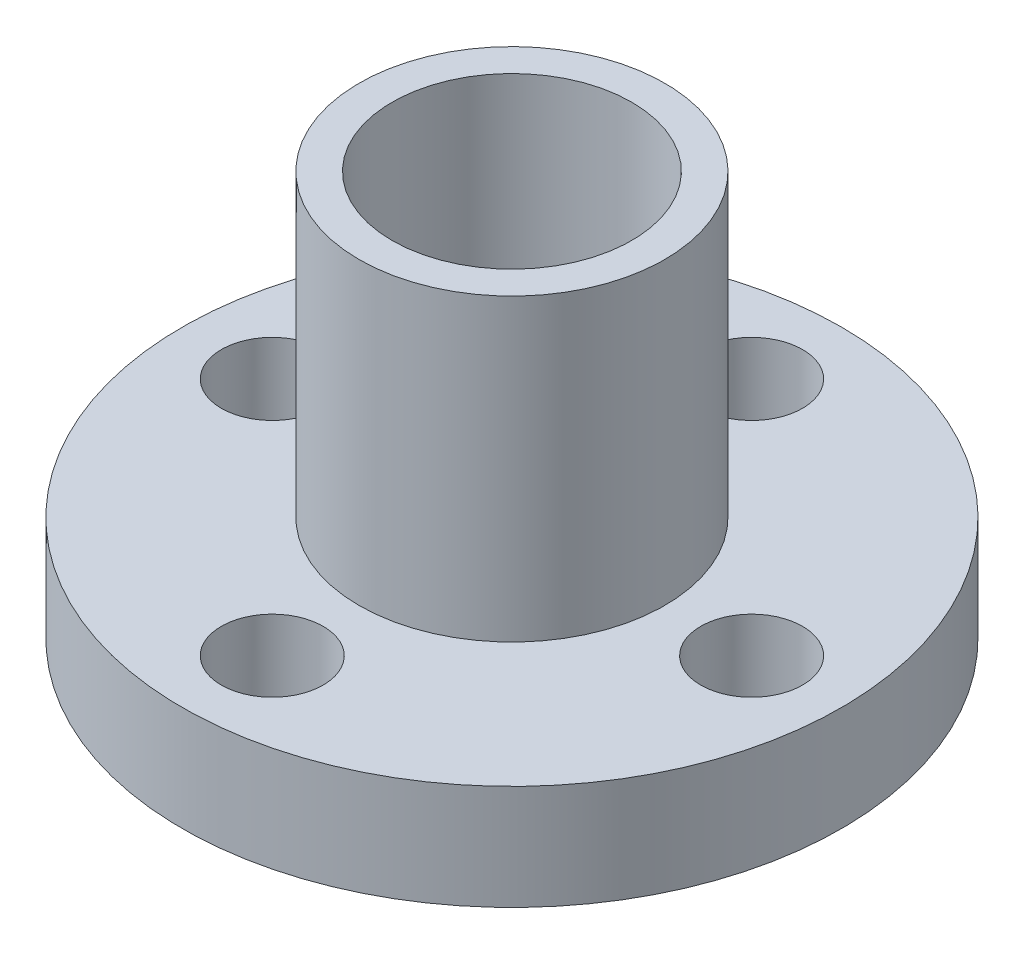
from build123d import *

# Parameters (mm, degrees)
SKETCH1_R            = 5.1
SKETCH1_R_2          = 4
BOSS_EXTRUDE1_DEPTH  = 10
SKETCH2_R            = 11
SKETCH2_R_2          = 4
BOSS_EXTRUDE2_DEPTH  = 3.5
SKETCH3_R            = 5.1
SKETCH3_R_2          = 4
BOSS_EXTRUDE3_DEPTH  = 1.5
M3_CLEARANCE_HOLE1_D = 3.4


with BuildPart() as part:
    # Sketch1 → Boss-Extrude1 (new body)
    with BuildSketch(Plane(origin=(0, 0, 0), x_dir=(1, 0, 0), z_dir=(0, 1, 0))):
        with Locations(Location((0, 0, 0), (0, 0, 270))):
            Circle(SKETCH1_R)
        with Locations(Location((0, 0, 0), (0, 0, 270))):
            Circle(SKETCH1_R_2, mode=Mode.SUBTRACT)
    extrude(amount=-BOSS_EXTRUDE1_DEPTH)

    # Sketch2 → Boss-Extrude2 (add)
    with BuildSketch(Plane.XZ.offset(10)):
        with Locations(Location((0, 0, 0), (0, 0, 270))):
            Circle(SKETCH2_R)
        with Locations(Location((0, 0, 0), (0, 0, 90))):
            Circle(SKETCH2_R_2, mode=Mode.SUBTRACT)
    extrude(amount=BOSS_EXTRUDE2_DEPTH)

    # Sketch3 → Boss-Extrude3 (add)
    with BuildSketch(Plane.XZ.offset(13.5)):
        with Locations(Location((0, 0, 0), (0, 0, 90))):
            Circle(SKETCH3_R)
        with Locations(Location((0, 0, 0), (0, 0, 90))):
            Circle(SKETCH3_R_2, mode=Mode.SUBTRACT)
    extrude(amount=BOSS_EXTRUDE3_DEPTH)

    # M3 Clearance Hole1 (through all)
    with Locations(Plane(origin=(0, -10, 0), x_dir=(1, 0, 0), z_dir=(0, 1, 0))):
        with Locations((8, 0), (0, 8), (0, -8), (-8, 0)):
            Hole(M3_CLEARANCE_HOLE1_D / 2)


solid = part.part
